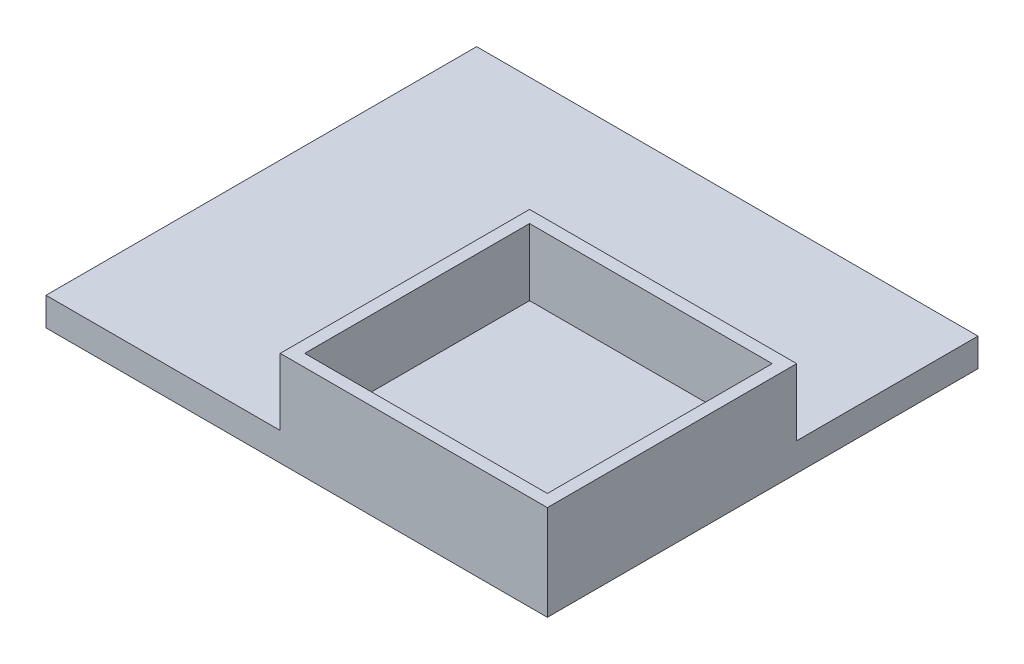
from build123d import *

# Parameters (mm, degrees)
SKETCH1_W           = 112.6
SKETCH1_H           = 40.72
BOSS_EXTRUDE1_DEPTH = 6.35
SKETCH2_W           = 112.6
SKETCH2_H           = 6.35
BOSS_EXTRUDE2_DEPTH = 56
SKETCH3_W           = 60
SKETCH3_H           = 56
SKETCH3_W_2         = 54.5
SKETCH3_H_2         = 50.5
BOSS_EXTRUDE3_DEPTH = 15


with BuildPart() as part:
    # Sketch1 → Boss-Extrude1 (new body)
    with BuildSketch(Plane(origin=(0, 0, 0), x_dir=(1, 0, 0), z_dir=(0, 1, 0))):
        Rectangle(SKETCH1_W, SKETCH1_H)
    extrude(amount=BOSS_EXTRUDE1_DEPTH)

    # Sketch2 → Boss-Extrude2 (add)
    with BuildSketch(Plane.XY.offset(20.36)):
        with Locations((0, 3.175)):
            Rectangle(SKETCH2_W, SKETCH2_H)
    extrude(amount=BOSS_EXTRUDE2_DEPTH)

    # Sketch3 → Boss-Extrude3 (add)
    with BuildSketch(Plane(origin=(0, 6.35, 0), x_dir=(1, 0, 0), z_dir=(0, 1, 0))):
        with Locations((26.3, -48.36)):
            Rectangle(SKETCH3_W, SKETCH3_H)
        with Locations((26.3, -48.36)):
            Rectangle(SKETCH3_W_2, SKETCH3_H_2, mode=Mode.SUBTRACT)
    extrude(amount=BOSS_EXTRUDE3_DEPTH)


solid = part.part
